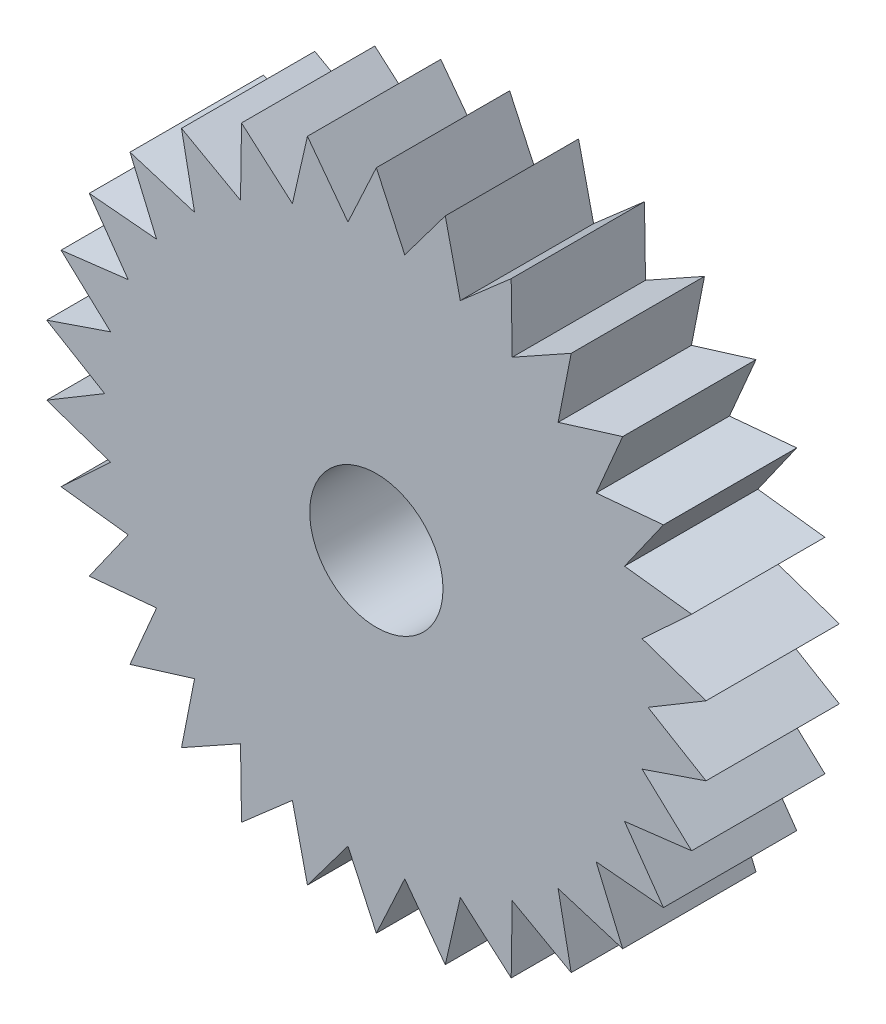
from build123d import *

# Parameters (mm, degrees)
SKETCH1_R           = 1
BOSS_EXTRUDE3_DEPTH = 2


with BuildPart() as part:
    # Sketch1 → Boss-Extrude3 (new body)
    with BuildSketch(Plane.XY):
        Polygon((0, 4.973839636), (-0.426100438, 4.054074865), (-1.034119408, 4.865149306), (-1.259678681, 3.87689234), (-2.023042837, 4.543828606), (-2.038202921, 3.530271016), (-2.923549585, 4.023920792), (-2.727647913, 3.029359908), (-3.696283188, 3.328148331), (-3.297881603, 2.396051237), (-4.307471479, 2.486919818), (-3.723982041, 1.658023628), (-4.730402596, 1.537000975), (-3.987326594, 0.847532431), (-4.946592422, 0.519907814), (-4.076405843, 0), (-4.946592422, -0.519907814), (-3.987326594, -0.847532431), (-4.730402596, -1.537000975), (-3.723982041, -1.658023628), (-4.307471479, -2.486919818), (-3.297881603, -2.396051237), (-3.696283188, -3.328148331), (-2.727647913, -3.029359908), (-2.923549585, -4.023920792), (-2.038202921, -3.530271016), (-2.023042837, -4.543828606), (-1.259678681, -3.87689234), (-1.034119408, -4.865149306), (-0.426100438, -4.054074865), (0, -4.973839636), (0.426100438, -4.054074865), (1.034119408, -4.865149306), (1.259678681, -3.87689234), (2.023042837, -4.543828606), (2.038202921, -3.530271016), (2.923549585, -4.023920792), (2.727647913, -3.029359908), (3.696283188, -3.328148331), (3.297881603, -2.396051237), (4.307471479, -2.486919818), (3.723982041, -1.658023628), (4.730402596, -1.537000975), (3.987326594, -0.847532431), (4.946592422, -0.519907814), (4.076405843, 0), (4.946592422, 0.519907814), (3.987326594, 0.847532431), (4.730402596, 1.537000975), (3.723982041, 1.658023628), (4.307471479, 2.486919818), (3.297881603, 2.396051237), (3.696283188, 3.328148331), (2.727647913, 3.029359908), (2.923549585, 4.023920792), (2.038202921, 3.530271016), (2.023042837, 4.543828606), (1.259678681, 3.87689234), (1.034119408, 4.865149306), (0.426100438, 4.054074865), align=None)
        Circle(SKETCH1_R, mode=Mode.SUBTRACT)
    extrude(amount=BOSS_EXTRUDE3_DEPTH)


solid = part.part
